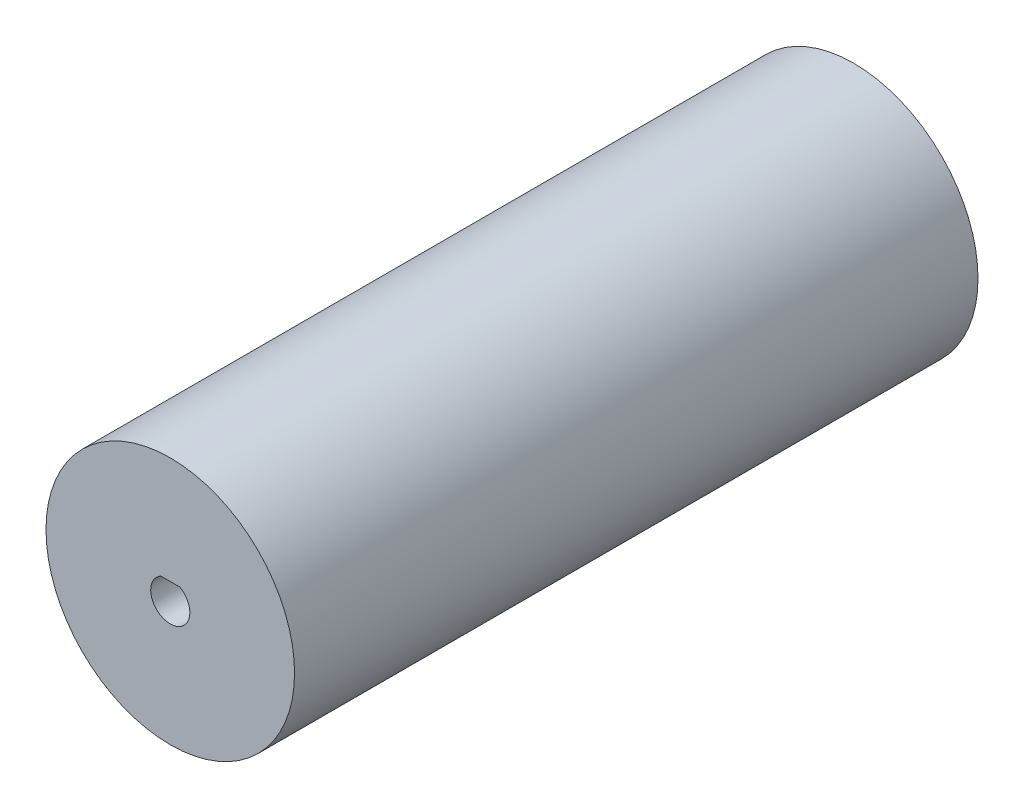
from build123d import *

# Parameters (mm, degrees)
SKETCH1_R           = 12.7
BOSS_EXTRUDE1_DEPTH = 69.85
CUT_EXTRUDE1_DEPTH  = 10
SKETCH3_R           = 2.999994
CUT_EXTRUDE2_DEPTH  = 34.925


with BuildPart() as part:
    # Sketch1 → Boss-Extrude1 (new body)
    with BuildSketch(Plane.XY):
        Circle(SKETCH1_R)
    extrude(amount=BOSS_EXTRUDE1_DEPTH)

    # Sketch2 → Cut-Extrude1 (cut)
    with BuildSketch(Plane.XY.offset(69.85)):
        with BuildLine():
            Line((-0.968245837, 1.75), (0.968245837, 1.75))
            ThreePointArc((0.968245837, 1.75), (0, -2), (-0.968245837, 1.75))
        make_face()
    extrude(amount=-CUT_EXTRUDE1_DEPTH, mode=Mode.SUBTRACT)

    # Sketch3 → Cut-Extrude2 (cut)
    with BuildSketch(Plane(origin=(0, 0, 0), x_dir=(-1, 0, 0), z_dir=(0, 0, -1))):
        Circle(SKETCH3_R)
    extrude(amount=-CUT_EXTRUDE2_DEPTH, mode=Mode.SUBTRACT)


solid = part.part
